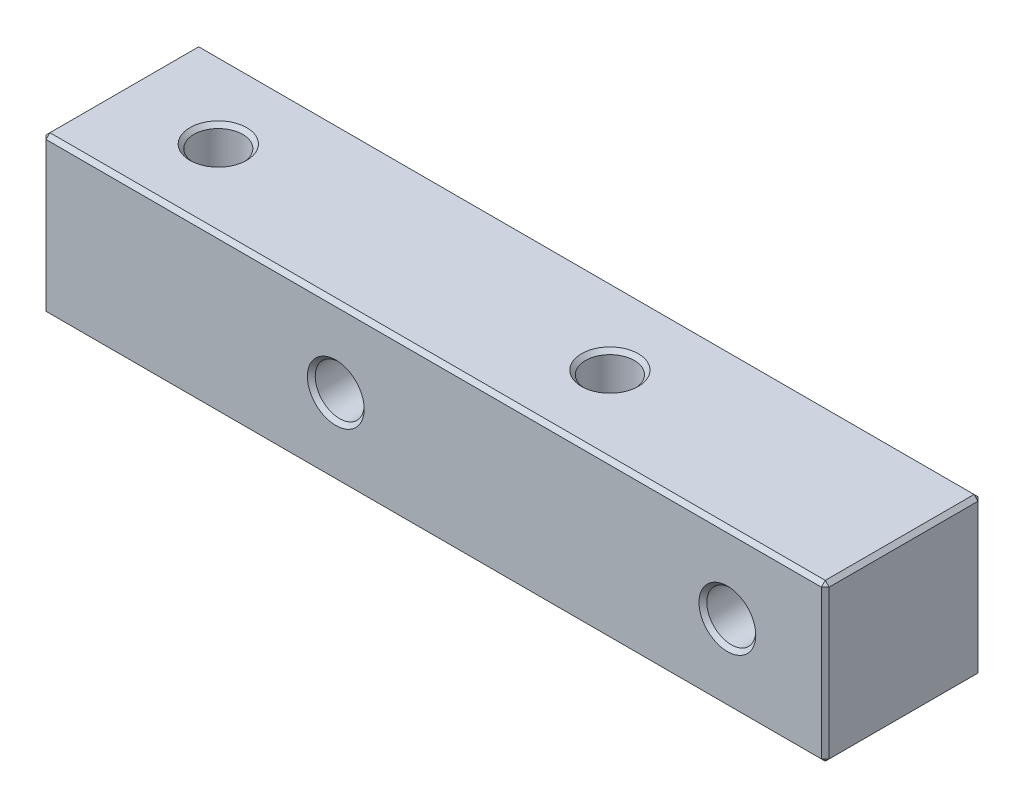
from build123d import *

# Parameters (mm, degrees)
SKETCH_1_W         = 40
SKETCH_1_H         = 8
EXTRUDE_1_DEPTH    = 4
HOLE_WIZARD_M3_1_D = 2.5
HOLE_WIZARD_M3_2_D = 2.5
CHAMFER_1_SIZE     = 0.2


with BuildPart() as part:
    # 草图1 → 凸台-拉伸1 (new, symmetric)
    with BuildSketch(Plane(origin=(0, 0, 0), x_dir=(1, 0, 0), z_dir=(0, 1, 0))):
        Rectangle(SKETCH_1_W, SKETCH_1_H)
    extrude(amount=EXTRUDE_1_DEPTH, both=True)

    # M3 螺纹孔1 (through all)
    with Locations(Plane(origin=(0, 4, 0), x_dir=(1, 0, 0), z_dir=(0, 1, 0))):
        with Locations((-15, 0), (5, 0)):
            Hole(HOLE_WIZARD_M3_1_D / 2)

    # M3 螺纹孔2 (through all)
    with Locations(Plane(origin=(0, 0, -4), x_dir=(-1, 0, 0), z_dir=(0, 0, -1))):
        with Locations((-15, 0), (5, 0)):
            Hole(HOLE_WIZARD_M3_2_D / 2)

    # 倒角1
    chamfer_1_edges = [part.edges().sort_by_distance(p)[0] for p in [
        (-20, 4, 0),
        (6.25, 4, 0),
        (6.25, -4, 0),
        (0, 4, 4),
        (-13.75, 4, 0),
        (-13.75, -4, 0),
        (-6.25, 0, -4),
        (-6.25, 0, 4),
        (13.75, 0, -4),
        (13.75, 0, 4),
        (20, 4, 0),
        (0, -4, 4),
        (-20, -4, 0),
        (0, -4, -4),
        (20, -4, 0),
        (20, 0, 4),
        (-20, 0, 4),
        (-20, 0, -4),
        (20, 0, -4),
        (0, 4, -4),
    ]]
    chamfer(chamfer_1_edges, length=CHAMFER_1_SIZE)


solid = part.part
